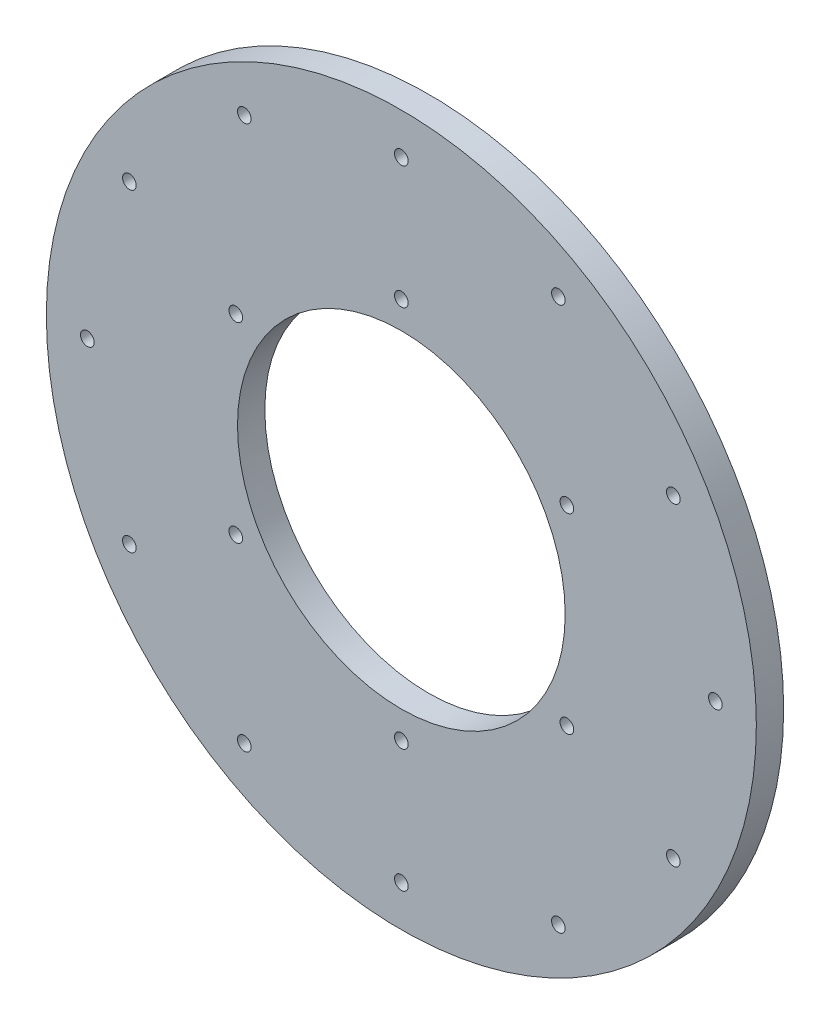
from build123d import *

# Parameters (mm, degrees)
SKETCH_1_R          = 130
SKETCH_1_R_2        = 60
EXTRUDE_1_DEPTH     = 10
SKETCH_2_R          = 2.5
CUT_EXTRUDE_1_DEPTH = 185.119526395
SKETCH_3_R          = 2.5
CUT_EXTRUDE_2_DEPTH = 185.119526395


with BuildPart() as part:
    # 草图1 → 凸台-拉伸1 (new body)
    with BuildSketch(Plane.XY):
        Circle(SKETCH_1_R)
        Circle(SKETCH_1_R_2, mode=Mode.SUBTRACT)
    extrude(amount=EXTRUDE_1_DEPTH)

    # 草图2 → 切除-拉伸1 (cut, through all)
    with BuildSketch(Plane.XY.offset(10)):
        with Locations((0, 70)):
            Circle(SKETCH_2_R)
        with Locations((60.621778265, 35)):
            Circle(SKETCH_2_R)
        with Locations((60.621778265, -35)):
            Circle(SKETCH_2_R)
        with Locations((0, -70)):
            Circle(SKETCH_2_R)
        with Locations((-60.621778265, -35)):
            Circle(SKETCH_2_R)
        with Locations((-60.621778265, 35)):
            Circle(SKETCH_2_R)
    extrude(amount=-CUT_EXTRUDE_1_DEPTH, mode=Mode.SUBTRACT)

    # 草图3 → 切除-拉伸2 (cut, through all)
    with BuildSketch(Plane.XY.offset(10)):
        with Locations((0, 115)):
            Circle(SKETCH_3_R)
        with Locations((57.5, 99.592921435)):
            Circle(SKETCH_3_R)
        with Locations((99.592921435, 57.5)):
            Circle(SKETCH_3_R)
        with Locations((115, 0)):
            Circle(SKETCH_3_R)
        with Locations((99.592921435, -57.5)):
            Circle(SKETCH_3_R)
        with Locations((57.5, -99.592921435)):
            Circle(SKETCH_3_R)
        with Locations((0, -115)):
            Circle(SKETCH_3_R)
        with Locations((-57.5, -99.592921435)):
            Circle(SKETCH_3_R)
        with Locations((-99.592921435, -57.5)):
            Circle(SKETCH_3_R)
        with Locations((-115, 0)):
            Circle(SKETCH_3_R)
        with Locations((-99.592921435, 57.5)):
            Circle(SKETCH_3_R)
        with Locations((-57.5, 99.592921435)):
            Circle(SKETCH_3_R)
    extrude(amount=-CUT_EXTRUDE_2_DEPTH, mode=Mode.SUBTRACT)


solid = part.part
